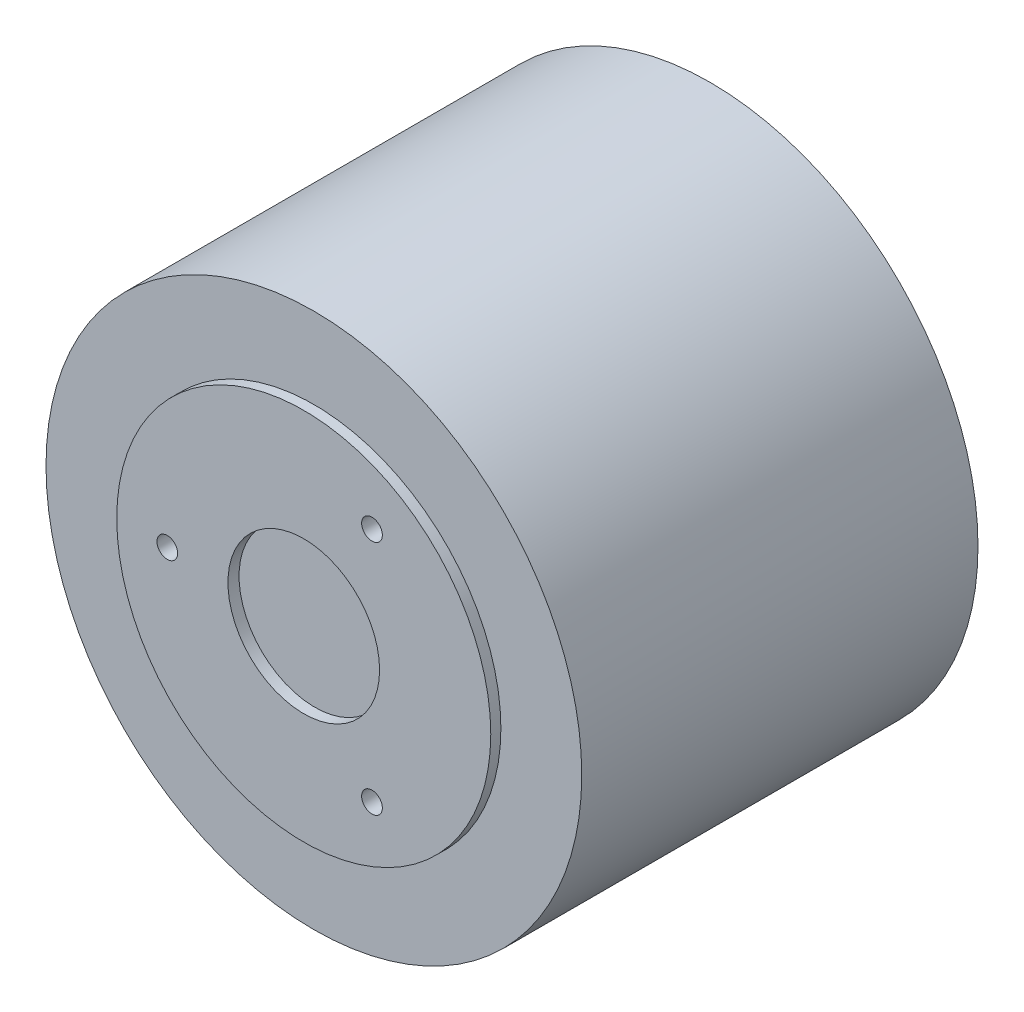
from build123d import *

# Parameters (mm, degrees)
F_0000_CYLINDER_SKETCH_R = 26.5
F_0000_CYLINDER_DEPTH    = 39.2
F_0002_CYLINDER_SKETCH_R = 18.5
F_0002_CYLINDER_DEPTH    = 1.5
F_0004_CYLINDER_SKETCH_R = 7.5
F_0004_CYLINDER_DEPTH    = 1.1
F_0006_CYLINDER_SKETCH_R = 1.025
F_0006_CYLINDER_DEPTH    = 3
F_0009_CYLINDER_SKETCH_R = 1.025
F_0009_CYLINDER_DEPTH    = 3
F_0012_CYLINDER_SKETCH_R = 1.025
F_0012_CYLINDER_DEPTH    = 3
F_0015_CYLINDER_SKETCH_R = 1.025
F_0015_CYLINDER_DEPTH    = 5
F_0018_CYLINDER_SKETCH_R = 1.025
F_0018_CYLINDER_DEPTH    = 5
F_0021_CYLINDER_SKETCH_R = 1.025
F_0021_CYLINDER_DEPTH    = 5
F_0024_CYLINDER_SKETCH_R = 1.025
F_0024_CYLINDER_DEPTH    = 5


with BuildPart() as part:
    # 0000_cylinder_Sketch → 0000_cylinder (new body)
    with BuildSketch(Plane.XY):
        Circle(F_0000_CYLINDER_SKETCH_R)
    extrude(amount=F_0000_CYLINDER_DEPTH)


with BuildPart() as part_1:
    # 0000_cylinder_Translate: moved
    add(part.part.moved(Location((0, 0, -40.2))))


with BuildPart() as body_2:
    # 0002_cylinder_Sketch → 0002_cylinder (new body)
    with BuildSketch(Plane.XY):
        Circle(F_0002_CYLINDER_SKETCH_R)
    extrude(amount=F_0002_CYLINDER_DEPTH)


with BuildPart() as body_2_1:
    # 0002_cylinder_Translate: moved
    add(body_2.part.moved(Location((0, 0, -1.5))))


with BuildPart() as part_2:
    add(part_1.part)

    # 0003_add: union body 2
    add(body_2_1.part)


with BuildPart() as body_2_2:
    # 0004_cylinder_Sketch → 0004_cylinder (new body)
    with BuildSketch(Plane.XY):
        Circle(F_0004_CYLINDER_SKETCH_R)
    extrude(amount=F_0004_CYLINDER_DEPTH)


with BuildPart() as body_2_2_1:
    # 0004_cylinder_Translate: moved
    add(body_2_2.part.moved(Location((0, 0, -1.1))))


with BuildPart() as part_3:
    add(part_2.part)

    # 0005_sub: cut body 2 2
    add(body_2_2_1.part, mode=Mode.SUBTRACT)


with BuildPart() as body_2_3:
    # 0006_cylinder_Sketch → 0006_cylinder (new body)
    with BuildSketch(Plane.XY):
        Circle(F_0006_CYLINDER_SKETCH_R)
    extrude(amount=F_0006_CYLINDER_DEPTH)


with BuildPart() as body_2_3_1:
    # 0006_cylinder_Translate: moved
    add(body_2_3.part.moved(Location((6.75, 11.691342951, -3))))


with BuildPart() as part_4:
    add(part_3.part)

    # 0008_sub: cut body 2 3
    add(body_2_3_1.part, mode=Mode.SUBTRACT)


with BuildPart() as body_2_4:
    # 0009_cylinder_Sketch → 0009_cylinder (new body)
    with BuildSketch(Plane.XY):
        Circle(F_0009_CYLINDER_SKETCH_R)
    extrude(amount=F_0009_CYLINDER_DEPTH)


with BuildPart() as body_2_4_1:
    # 0009_cylinder_Translate: moved
    add(body_2_4.part.moved(Location((6.75, -11.691342951, -3))))


with BuildPart() as part_5:
    add(part_4.part)

    # 0011_sub: cut body 2 4
    add(body_2_4_1.part, mode=Mode.SUBTRACT)


with BuildPart() as body_2_5:
    # 0012_cylinder_Sketch → 0012_cylinder (new body)
    with BuildSketch(Plane.XY):
        Circle(F_0012_CYLINDER_SKETCH_R)
    extrude(amount=F_0012_CYLINDER_DEPTH)


with BuildPart() as body_2_5_1:
    # 0012_cylinder_Translate: moved
    add(body_2_5.part.moved(Location((-13.5, 0, -3))))


with BuildPart() as part_6:
    add(part_5.part)

    # 0014_sub: cut body 2 5
    add(body_2_5_1.part, mode=Mode.SUBTRACT)


with BuildPart() as body_2_6:
    # 0015_cylinder_Sketch → 0015_cylinder (new body)
    with BuildSketch(Plane.XY):
        Circle(F_0015_CYLINDER_SKETCH_R)
    extrude(amount=F_0015_CYLINDER_DEPTH)


with BuildPart() as body_2_6_1:
    # 0015_cylinder_Translate: moved
    add(body_2_6.part.moved(Location((0, 23.5, -40.2))))


with BuildPart() as part_7:
    add(part_6.part)

    # 0017_sub: cut body 2 6
    add(body_2_6_1.part, mode=Mode.SUBTRACT)


with BuildPart() as body_2_7:
    # 0018_cylinder_Sketch → 0018_cylinder (new body)
    with BuildSketch(Plane.XY):
        Circle(F_0018_CYLINDER_SKETCH_R)
    extrude(amount=F_0018_CYLINDER_DEPTH)


with BuildPart() as body_2_7_1:
    # 0018_cylinder_Translate: moved
    add(body_2_7.part.moved(Location((23.5, 0, -40.2))))


with BuildPart() as part_8:
    add(part_7.part)

    # 0020_sub: cut body 2 7
    add(body_2_7_1.part, mode=Mode.SUBTRACT)


with BuildPart() as body_2_8:
    # 0021_cylinder_Sketch → 0021_cylinder (new body)
    with BuildSketch(Plane.XY):
        Circle(F_0021_CYLINDER_SKETCH_R)
    extrude(amount=F_0021_CYLINDER_DEPTH)


with BuildPart() as body_2_8_1:
    # 0021_cylinder_Translate: moved
    add(body_2_8.part.moved(Location((0, -23.5, -40.2))))


with BuildPart() as part_9:
    add(part_8.part)

    # 0023_sub: cut body 2 8
    add(body_2_8_1.part, mode=Mode.SUBTRACT)


with BuildPart() as body_2_9:
    # 0024_cylinder_Sketch → 0024_cylinder (new body)
    with BuildSketch(Plane.XY):
        Circle(F_0024_CYLINDER_SKETCH_R)
    extrude(amount=F_0024_CYLINDER_DEPTH)


with BuildPart() as body_2_9_1:
    # 0024_cylinder_Translate: moved
    add(body_2_9.part.moved(Location((-23.5, 0, -40.2))))


with BuildPart() as part_10:
    add(part_9.part)

    # 0026_sub: cut body 2 9
    add(body_2_9_1.part, mode=Mode.SUBTRACT)


solid = part_10.part
